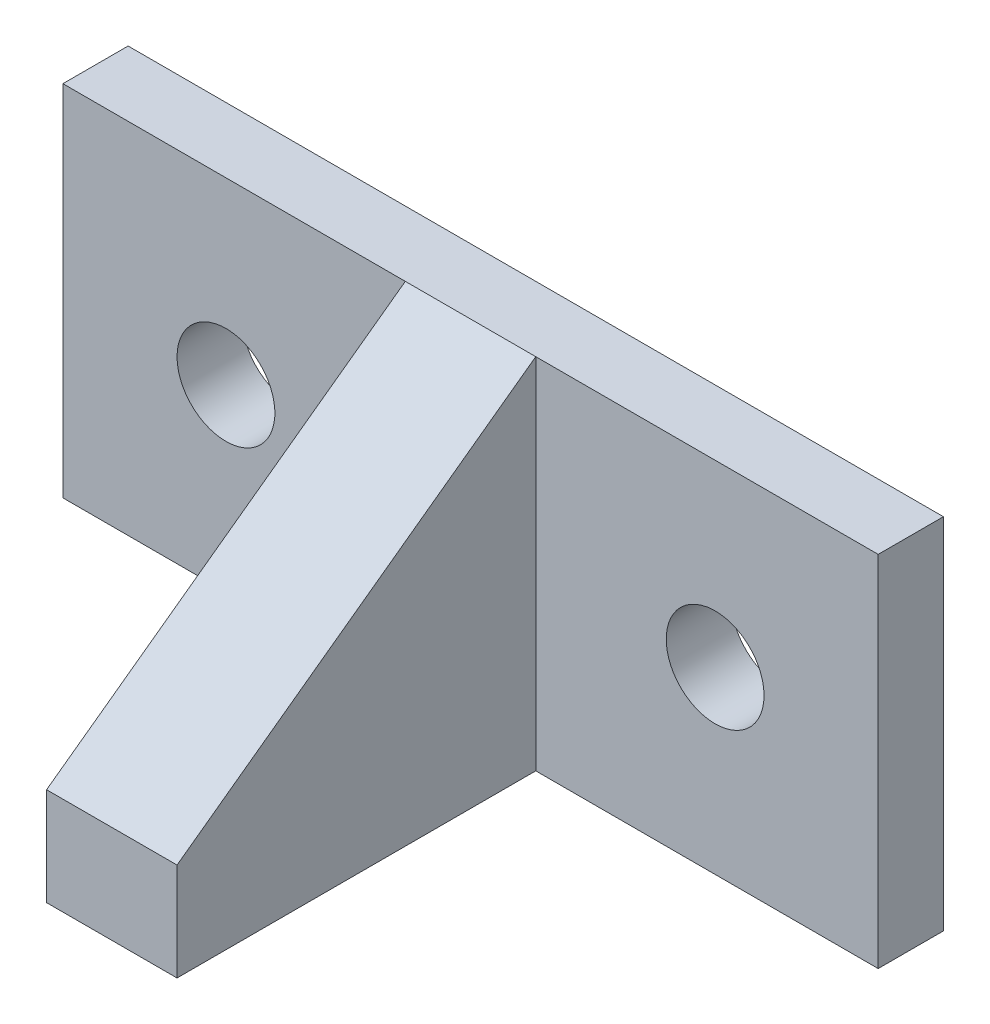
from build123d import *

# Parameters (mm, degrees)
SKETCH1_W                = 125
SKETCH1_H                = 55
SKETCH1_R                = 7.5
BOSS_EXTRUDE1_DEPTH      = 10
BOSS_EXTRUDE2_DEPTH      = 10
BOSS_EXTRUDE2_DEPTH_BACK = 10


with BuildPart() as part:
    # Sketch1 → Boss-Extrude1 (new body)
    with BuildSketch(Plane.XY):
        Rectangle(SKETCH1_W, SKETCH1_H)
        with Locations((37.5, 0)):
            Circle(SKETCH1_R, mode=Mode.SUBTRACT)
        with Locations(Location((-37.5, 0, 0), (0, 0, 180))):
            Circle(SKETCH1_R, mode=Mode.SUBTRACT)
    extrude(amount=BOSS_EXTRUDE1_DEPTH)

    # Sketch2 → Boss-Extrude2 (add, two sides: drawn at the far end of the back side and taken through both)
    with BuildSketch(Plane(origin=(0, 0, 0), x_dir=(0, 0, -1), z_dir=(1, 0, 0)).offset(-BOSS_EXTRUDE2_DEPTH_BACK)):
        Polygon((-10, -27.5), (-65, -27.5), (-65, -12.5), (-10, 27.5), align=None)
    extrude(amount=BOSS_EXTRUDE2_DEPTH + BOSS_EXTRUDE2_DEPTH_BACK)


solid = part.part
